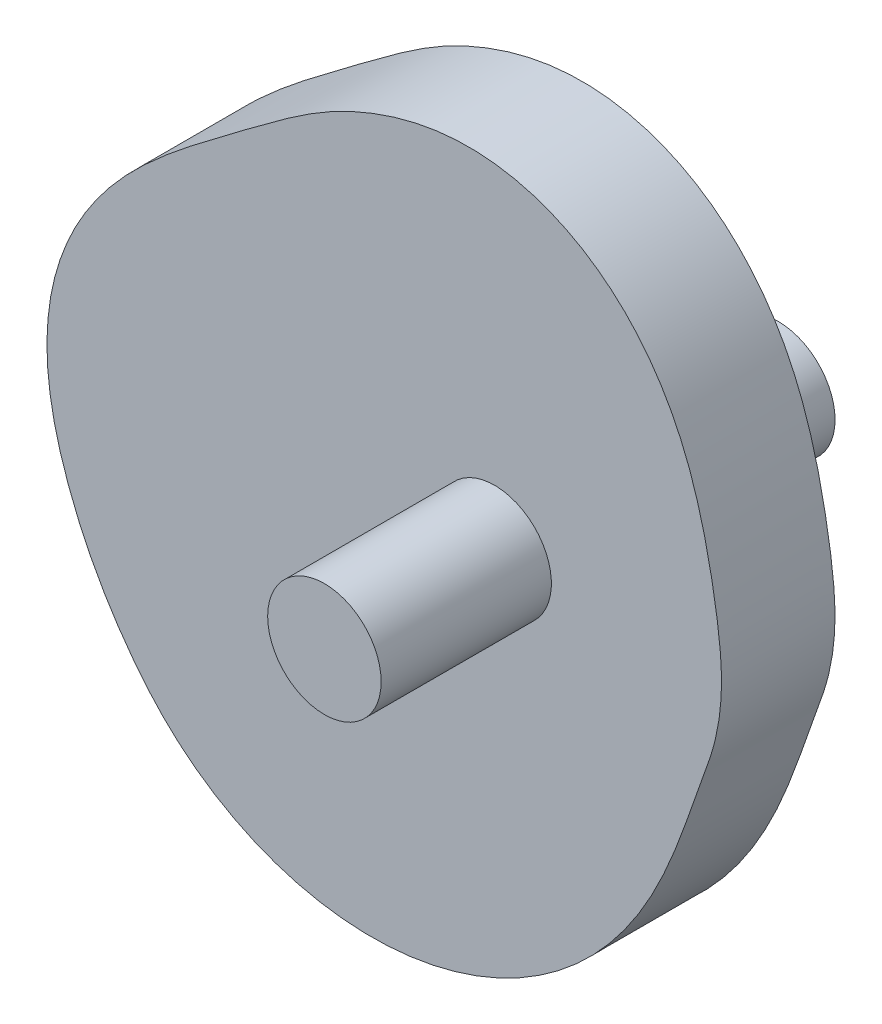
from build123d import *

# Parameters (mm, degrees)
SKETCH5_R           = 5
BOSS_EXTRUDE3_DEPTH = 20
BOSS_EXTRUDE4_DEPTH = 5


with BuildPart() as part:
    # Sketch5 → Boss-Extrude3 (new, symmetric)
    with BuildSketch(Plane.XY):
        Circle(SKETCH5_R)
    extrude(amount=BOSS_EXTRUDE3_DEPTH, both=True)

    # Sketch9 → Boss-Extrude4 (add, symmetric)
    with BuildSketch(Plane.XY):
        with BuildLine():
            add(Edge.make_bspline(
                [(19.997028003, 0.349049422), (19.993141867, 0.581738082), (19.977743288, 1.047037665), (19.935363748, 1.744245922), (19.876427249, 2.440784445), (19.803370726, 3.137010381), (19.718174435, 3.833546152), (19.622401219, 4.531216934), (19.517187688, 5.230990572), (19.40325546, 5.933920129), (19.280923813, 6.641089551), (19.15012836, 7.353562767), (19.01044402, 8.072336492), (18.861112195, 8.798296994), (18.701071539, 9.532181013), (18.528991838, 10.274541053), (18.343310432, 11.025715195), (18.142270672, 11.785801616), (17.923961864, 12.554637912), (17.686360214, 13.331785328), (17.427370283, 14.116517927), (17.144866476, 14.907816694), (16.836734113, 15.704368508), (16.500909632, 16.504569898), (16.135419505, 17.306535408), (15.738417426, 18.10811041), (15.308219394, 18.906888118), (14.843336299, 19.70023056), (14.342503647, 20.485293206), (13.804708093, 21.25905294), (13.229210478, 22.018339035), (12.615565083, 22.759866752), (11.963634855, 23.480273187), (11.273602391, 24.176154955), (10.545976493, 24.844107276), (9.781594159, 25.480764051), (8.981617879, 26.082838444), (8.147528178, 26.647163543), (7.28111137, 27.170732605), (6.3844425, 27.650738435), (5.459863544, 28.084611403), (4.509956922, 28.470055629), (3.537514453, 28.80508286), (2.545501909, 29.088043567), (1.537019375, 29.317654779), (0.515257653, 29.493024227), (-0.516548993, 29.613670334), (-1.555173429, 29.679537635), (-2.597449209, 29.691007257), (-3.640326657, 29.648902002), (-4.680931165, 29.554486027), (-5.716622763, 29.40945761), (-6.74505818, 29.215939327), (-7.76424851, 28.976448312), (-8.772635749, 28.693910415), (-9.769098426, 28.37147942), (-10.753206857, 28.013056964), (-11.724317994, 27.620764728), (-12.681124693, 27.194757585), (-13.622470346, 26.735606598), (-14.54728454, 26.243990026), (-15.454146691, 25.719967081), (-16.34360893, 25.166776567), (-17.218721376, 24.59041471), (-18.082684051, 23.995545948), (-18.939186839, 23.386220623), (-19.792088865, 22.765530132), (-20.645254526, 22.135591462), (-21.502341262, 21.49748841), (-22.36660484, 20.85127165), (-23.240714691, 20.195991432), (-24.126590277, 19.529769898), (-25.025262801, 18.849909068), (-25.936766669, 18.153031048), (-26.860063798, 17.435244382), (-27.793003351, 16.692329305), (-28.732318759, 15.919933872), (-29.673663059, 15.113772926), (-30.611682324, 14.269822188), (-31.540125594, 13.384500368), (-32.4519882, 12.454832868), (-33.339684033, 11.478591458), (-34.195241185, 10.454405226), (-35.010514479, 9.381839097), (-35.777407816, 8.261437324), (-36.488098949, 7.094730511), (-37.135259131, 5.884205896), (-37.712260206, 4.633241811), (-38.213361923, 3.346008453), (-38.633872672, 2.027338286), (-38.970277474, 0.682570693), (-39.220327997, -0.682623271), (-39.383090618, -2.062429017), (-39.458950314, -3.451081556), (-39.449569881, -4.843055249), (-39.357806755, -6.233242113), (-39.187589016, -7.617110339), (-38.943763534, -8.99083939), (-38.631893815, -10.35141576), (-38.258122586, -11.696725972), (-37.828704111, -13.025493481), (-37.350724267, -14.337602543), (-36.827692872, -15.632426782), (-36.259668795, -16.908161857), (-35.647500836, -18.163308606), (-34.991893667, -19.396323655), (-34.293654211, -20.605705631), (-33.553641658, -21.789991798), (-32.772715463, -22.94769558), (-31.951987118, -24.077570605), (-31.091869892, -25.177612955), (-30.195704152, -26.248700648), (-29.240673775, -27.26761781), (-28.232565553, -28.232940044), (-27.17406981, -29.141172862), (-26.069000854, -29.989673253), (-24.921118289, -30.775913657), (-23.73440969, -31.497700999), (-22.512984656, -32.153133425), (-21.261071678, -32.740624583), (-19.982986582, -33.25890713), (-18.683107884, -33.70703902), (-17.365849839, -34.084406213), (-16.035635913, -34.390723498), (-14.696872178, -34.626032954), (-13.353921019, -34.790700209), (-12.011075292, -34.885408481), (-10.672533125, -34.911150474), (-9.34237356, -34.869218177), (-8.024533189, -34.761190667), (-6.722783977, -34.58891999), (-5.440712403, -34.354515254), (-4.181700099, -34.060325036), (-2.948906093, -33.708918263), (-1.745250808, -33.303063684), (-0.573401906, -32.845708121), (0.564237908, -32.339953645), (1.665541053, -31.789033863), (2.728663134, -31.196289484), (3.752048848, -30.565143366), (4.734435715, -29.899075216), (5.674855589, -29.201596152), (6.572633972, -28.476223299), (7.427387136, -27.726454631), (8.239017083, -26.955744235), (9.007704398, -26.167478181), (9.733899058, -25.364951191), (10.418309273, -24.551344276), (11.061888456, -23.729703497), (11.665820439, -22.902920024), (12.231503048, -22.07371164), (12.760530169, -21.244605813), (13.254672473, -20.417924476), (13.715856927, -19.595770626), (14.146145282, -18.780016836), (14.547711693, -17.97229577), (14.922819661, -17.173992776), (15.273798469, -16.386240601), (15.603019298, -15.609916282), (15.912871212, -14.845640234), (16.205737173, -14.093777523), (16.483970297, -13.354441346), (16.74987043, -12.627498623), (17.005661483, -11.912577748), (17.253468769, -11.209078112), (17.495299746, -10.516182342), (17.733016629, -9.832867246), (17.968343689, -9.157927498), (18.202753326, -8.489959959), (18.437804868, -7.827499366), (18.673813219, -7.168617024), (18.914591298, -6.51286668), (19.129876148, -5.848578963), (19.322467813, -5.177443671), (19.491351755, -4.499931764), (19.636532942, -3.816955792), (19.757778489, -3.129324512), (19.854953972, -2.437881966), (19.927943821, -1.743468832), (19.976634516, -1.046931835), (20.001062301, -0.349118145), (20.000913935, 0.11637292), (19.997028003, 0.349049422)],
                knots=[0, 0, 0, 0, 0.003623284, 0.007247514, 0.010874305, 0.01450618, 0.018146551, 0.021799639, 0.025470351, 0.029164128, 0.032886762, 0.036644212, 0.040442419, 0.044287127, 0.04818373, 0.052137136, 0.056151661, 0.060230953, 0.064377939, 0.068594805, 0.07288299, 0.077243205, 0.081675467, 0.086179145, 0.090753015, 0.095395324, 0.100103853, 0.10487599, 0.109708799, 0.114599088, 0.119543479, 0.12453847, 0.129580499, 0.134666, 0.139791453, 0.144953432, 0.150148646, 0.155373966, 0.160626459, 0.165903396, 0.171202271, 0.176520797, 0.181856901, 0.187208712, 0.192574542, 0.197952856, 0.203342248, 0.208741403, 0.214149073, 0.219564041, 0.224985107, 0.230411072, 0.235840751, 0.241273001, 0.246706778, 0.252141235, 0.257575859, 0.263010491, 0.268445122, 0.273879754, 0.279314385, 0.284749028, 0.290184012, 0.295620787, 0.301062663, 0.306515184, 0.311986293, 0.317486258, 0.323027349, 0.32862326, 0.334288347, 0.340036735, 0.34588142, 0.351833428, 0.357901147, 0.364089857, 0.370401508, 0.376834722, 0.383385016, 0.390045196, 0.396805878, 0.403656108, 0.410584006, 0.417577417, 0.424624512, 0.431714317, 0.438837128, 0.445984793, 0.453150856, 0.460330548, 0.467520648, 0.474719225, 0.481925305, 0.489138499, 0.496358643, 0.503585491, 0.510818502, 0.518056748, 0.52529895, 0.532543658, 0.539789528, 0.547035692, 0.554281867, 0.561528043, 0.568774218, 0.576020393, 0.583266568, 0.590512744, 0.597758919, 0.605005094, 0.612251269, 0.619497156, 0.626741624, 0.633982829, 0.641218579, 0.648446664, 0.655664842, 0.662870834, 0.670062315, 0.67723691, 0.684392187, 0.691525649, 0.698634733, 0.705716808, 0.712769168, 0.719789035, 0.726773554, 0.733719802, 0.740624783, 0.747485433, 0.75429863, 0.761061192, 0.76776989, 0.774421455, 0.781012588, 0.78753997, 0.794000276, 0.800390187, 0.806706407, 0.812945678, 0.819104797, 0.825180638, 0.831170167, 0.837070468, 0.842878765, 0.848592445, 0.854209088, 0.859726488, 0.865142689, 0.870456012, 0.875665089, 0.880768896, 0.88576679, 0.890658549, 0.895444406, 0.900125093, 0.904701881, 0.90917662, 0.913551781, 0.917830493, 0.922016579, 0.926114582, 0.930129792, 0.934068251, 0.937936755, 0.941742838, 0.945494729, 0.949201301, 0.95287199, 0.956516699, 0.960145675, 0.963769117, 0.967392205, 0.971015292, 0.97463838, 0.978261467, 0.981884555, 0.985507643, 0.98913073, 0.992753818, 0.996376906, 1, 1, 1, 1], degree=3))
        make_face()
    extrude(amount=BOSS_EXTRUDE4_DEPTH, both=True)


solid = part.part
